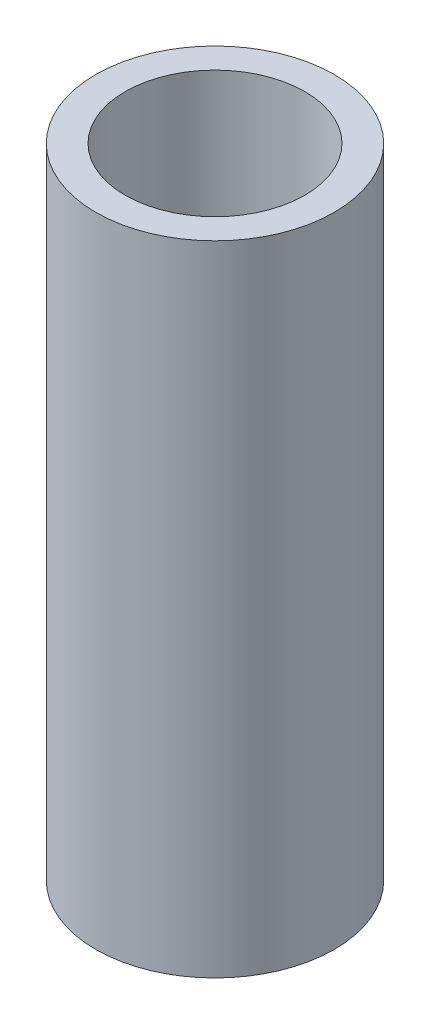
from build123d import *

# Parameters (mm, degrees)
SKETCH1_R           = 2.65
SKETCH1_R_2         = 1.995
BOSS_EXTRUDE1_DEPTH = 14.18


with BuildPart() as part:
    # Sketch1 → Boss-Extrude1 (new body)
    with BuildSketch(Plane(origin=(0, 0, 0), x_dir=(1, 0, 0), z_dir=(0, 1, 0))):
        with Locations(Location((0, 0, 0), (0, 0, 270))):
            Circle(SKETCH1_R)
        with Locations(Location((0, 0, 0), (0, 0, 270))):
            Circle(SKETCH1_R_2, mode=Mode.SUBTRACT)
    extrude(amount=BOSS_EXTRUDE1_DEPTH)


solid = part.part
